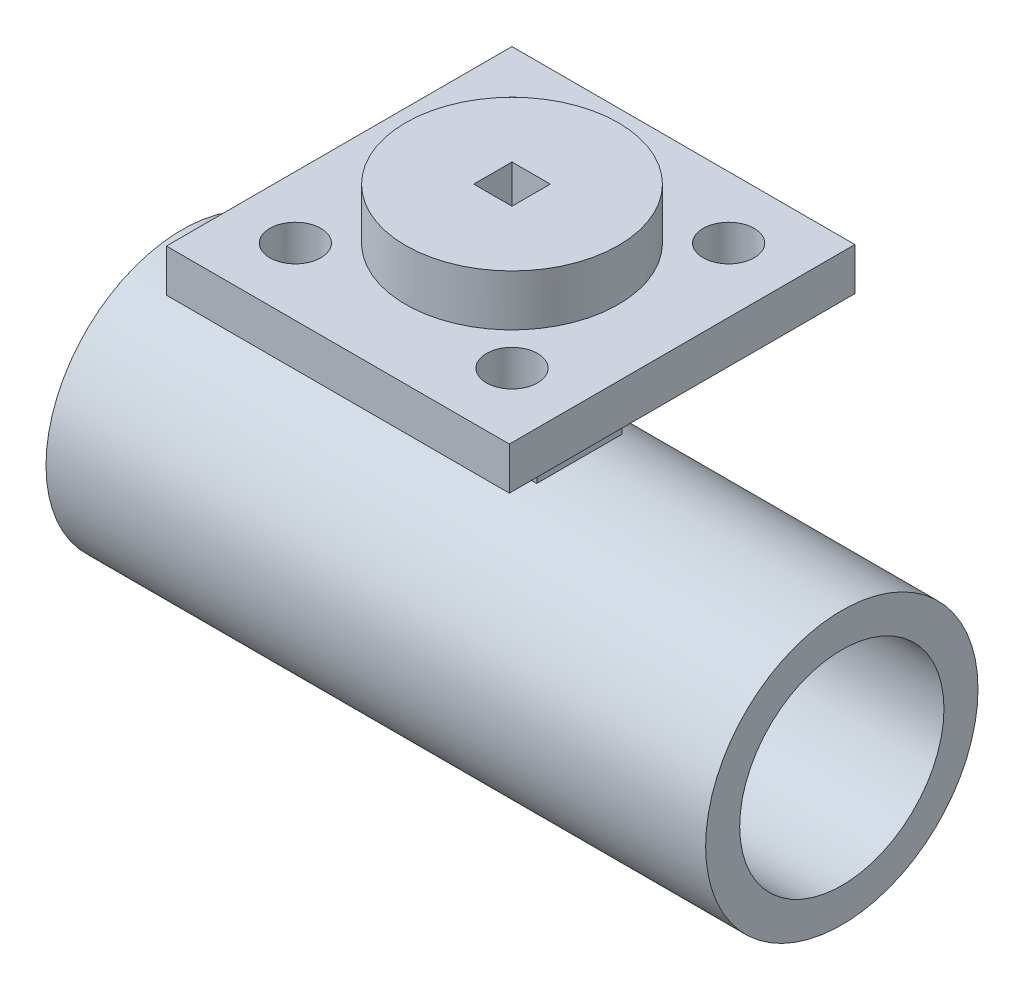
from build123d import *

# Parameters (mm, degrees)
DODANIE_WYCI_GNI_CIE1_DEPTH      = 16
DODANIE_WYCI_GNI_CIE1_DEPTH_BACK = 16
SZKIC2_R                         = 3
WYTNIJ_WYCI_GNI_CIE1_DEPTH       = 15
DODANIE_WYCI_GNI_CIE2_DEPTH      = 6
SZKIC5_W                         = 15.832735356
SZKIC5_H                         = 13
WYTNIJ_WYCI_GNI_CIE2_DEPTH       = 11
SZKIC6_W                         = 15.832735356
SZKIC6_H                         = 13
WYTNIJ_WYCI_GNI_CIE3_DEPTH       = 11
SZKIC7_W                         = 40.29170114
SZKIC7_H                         = 40.594635428
SZKIC7_W_2                       = 32
SZKIC7_H_2                       = 32
DODANIE_WYCI_GNI_CIE3_DEPTH      = 5


with BuildPart() as part:
    # Szkic1 → Dodanie-wyciągnięcie1 (new, two sides: drawn at the far end of the back side and taken through both)
    with BuildSketch(Plane.XY.offset(-DODANIE_WYCI_GNI_CIE1_DEPTH_BACK)):
        Polygon((30.833632322, 16), (46.666367678, 16), (46.666367678, 29), (54.75, 29), (54.75, 34), (22.75, 34), (22.75, 29), (30.833632322, 29), align=None)
    extrude(amount=DODANIE_WYCI_GNI_CIE1_DEPTH + DODANIE_WYCI_GNI_CIE1_DEPTH_BACK)

    # Szkic2 → Wytnij-wyciągnięcie1 (cut)
    with BuildSketch(Plane(origin=(0, 34, 0), x_dir=(1, 0, 0), z_dir=(0, 1, 0))):
        with Locations((51.477922061, 12.727922061)):
            Circle(SZKIC2_R)
        with Locations((26.022077939, 12.727922061)):
            Circle(SZKIC2_R)
        with Locations((51.477922061, -12.727922061)):
            Circle(SZKIC2_R)
        with Locations((26.022077939, -12.727922061)):
            Circle(SZKIC2_R)
    extrude(amount=-WYTNIJ_WYCI_GNI_CIE1_DEPTH, mode=Mode.SUBTRACT)

    # Szkic3 → Dodanie-wyciągnięcie2 (add)
    with BuildSketch(Plane(origin=(0, 34, 0), x_dir=(1, 0, 0), z_dir=(0, 1, 0))):
        with BuildLine():
            ThreePointArc((51.25, 0), (47.588834765, 8.838834765), (38.75, 12.5))
            ThreePointArc((38.75, 12.5), (29.911165235, -8.838834765), (51.25, 0))
        make_face()
        Polygon((36.500021314, 2.249743185), (38.75, 2.249743185), (40.999978686, 2.249743185), (40.999978686, -2.249743185), (36.500021314, -2.249743185), align=None, mode=Mode.SUBTRACT)
    extrude(amount=DODANIE_WYCI_GNI_CIE2_DEPTH)

    # Szkic5 → Wytnij-wyciągnięcie2 (cut)
    with BuildSketch(Plane.XY.offset(16)):
        with Locations((38.75, 22.5)):
            Rectangle(SZKIC5_W, SZKIC5_H)
    extrude(amount=-WYTNIJ_WYCI_GNI_CIE2_DEPTH, mode=Mode.SUBTRACT)

    # Szkic6 → Wytnij-wyciągnięcie3 (cut)
    with BuildSketch(Plane(origin=(0, 0, -16), x_dir=(-1, 0, 0), z_dir=(0, 0, -1))):
        with Locations((-38.75, 22.5)):
            Rectangle(SZKIC6_W, SZKIC6_H)
    extrude(amount=-WYTNIJ_WYCI_GNI_CIE3_DEPTH, mode=Mode.SUBTRACT)

    # Szkic7 → Dodanie-wyciągnięcie3 (add)
    with BuildSketch(Plane(origin=(0, 34, 0), x_dir=(1, 0, 0), z_dir=(0, 1, 0))):
        with Locations((38.89571093, -0.304852178)):
            Rectangle(SZKIC7_W, SZKIC7_H)
        with Locations((38.75, 0)):
            Rectangle(SZKIC7_W_2, SZKIC7_H_2, mode=Mode.SUBTRACT)
    extrude(amount=-DODANIE_WYCI_GNI_CIE3_DEPTH)


with BuildPart() as body_2:
    # Szkic4 → Obrót2 (revolve)
    with BuildSketch(Plane.XY):
        Polygon((0, 16), (0, 12), (77.5, 12), (77.5, 16), (46.666367678, 16), (30.833632322, 16), align=None)
    revolve(axis=Axis((0, 0, 0), (1, 0, 0)))


solid = Compound([part.part, body_2.part])
